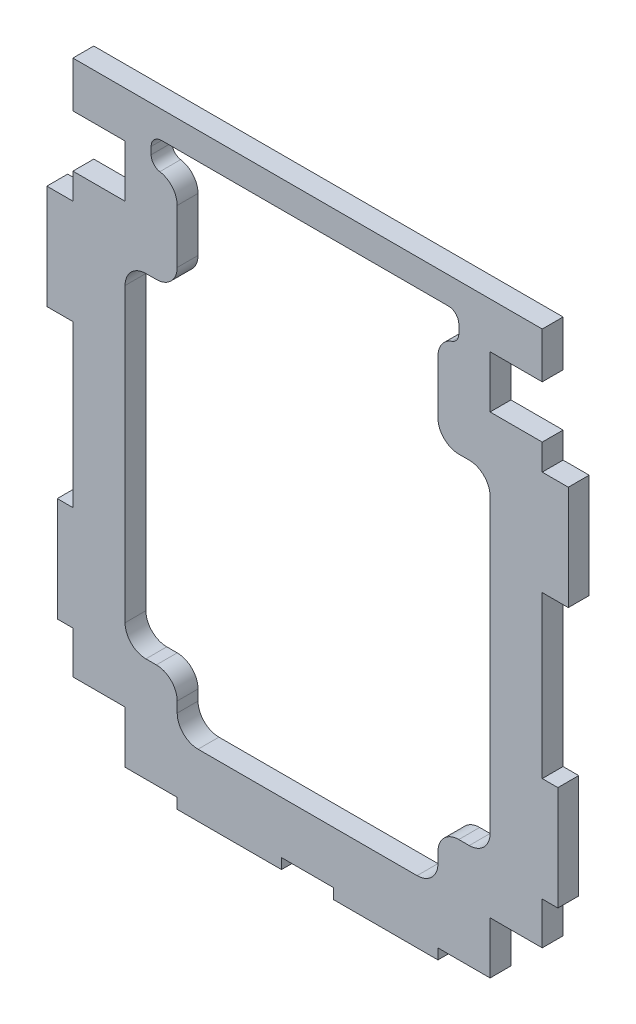
from build123d import *

# Parameters (mm, degrees)
EXTRUDE_1_DEPTH = 2


with BuildPart() as part:
    # Model → 凸台-拉伸1 (new body)
    with BuildSketch(Plane.XY):
        Polygon((1047.912570376, 680.457705055), (1047.912570376, 676.068532902), (1052.912570376, 676.068532902), (1052.912570376, 671.068532902), (1047.912570376, 671.068532902), (1047.912570376, 668.573157352), (1045.412570376, 668.573157352), (1045.412570376, 658.573157352), (1047.912570376, 658.573157352), (1047.912570376, 643.128332902), (1046.412570376, 643.128332902), (1046.412570376, 633.128332902), (1047.912570376, 633.128332902), (1047.912570376, 629.068532902), (1052.912570376, 629.068532902), (1052.912570376, 624.068532902), (1057.912570376, 624.068532902), (1057.912570376, 623.068532902), (1067.912570376, 623.068532902), (1067.912570376, 624.068532902), (1072.912570376, 624.068532902), (1072.912570376, 623.068532902), (1082.912570376, 623.068532902), (1082.912570376, 624.068532902), (1087.912570376, 624.068532902), (1087.912570376, 629.068532902), (1092.912570376, 629.068532902), (1092.912570376, 633.128332902), (1094.412570376, 633.128332902), (1094.412570376, 643.128332902), (1092.912570376, 643.128332902), (1092.912570376, 658.573157352), (1095.412570376, 658.573157352), (1095.412570376, 668.573157352), (1092.912570376, 668.573157352), (1092.912570376, 671.068532902), (1087.912570376, 671.068532902), (1087.912570376, 676.068532902), (1092.912570376, 676.068532902), (1092.912570376, 680.457705055), align=None)
        with BuildLine():
            Line((1057.912570376, 668.068532902), (1057.912570376, 673.218532902))
            ThreePointArc((1057.912570376, 673.218532902), (1057.440095607, 674.509527351), (1056.245903709, 675.190559496))
            ThreePointArc((1056.245903709, 675.190559496), (1055.64880776, 675.531075569), (1055.412570376, 676.176572793))
            Line((1055.412570376, 676.176572793), (1055.412570376, 676.867577668))
            ThreePointArc((1055.412570376, 676.867577668), (1055.705463595, 677.57468445), (1056.412570376, 677.867577668))
            Line((1056.412570376, 677.867577668), (1083.912570376, 677.867577668))
            ThreePointArc((1083.912570376, 677.867577668), (1084.619677157, 677.57468445), (1084.912570376, 676.867577668))
            Line((1084.912570376, 676.867577668), (1084.912570376, 676.046960027))
            ThreePointArc((1084.912570376, 676.046960027), (1084.729066957, 675.469609757), (1084.245903709, 675.104150985))
            ThreePointArc((1084.245903709, 675.104150985), (1083.279577214, 674.37323344), (1082.912570376, 673.218532902))
            Line((1082.912570376, 673.218532902), (1082.912570376, 668.068532902))
            ThreePointArc((1082.912570376, 668.068532902), (1083.498356813, 666.65431934), (1084.912570376, 666.068532902))
            Line((1084.912570376, 666.068532902), (1085.912570376, 666.068532902))
            ThreePointArc((1085.912570376, 666.068532902), (1087.326783938, 665.482746464), (1087.912570376, 664.068532902))
            Line((1087.912570376, 664.068532902), (1087.912570376, 636.068532902))
            ThreePointArc((1087.912570376, 636.068532902), (1087.326783938, 634.65431934), (1085.912570376, 634.068532902))
            Line((1085.912570376, 634.068532902), (1084.912570376, 634.068532902))
            ThreePointArc((1084.912570376, 634.068532902), (1083.498356813, 633.482746464), (1082.912570376, 632.068532902))
            Line((1082.912570376, 632.068532902), (1082.912570376, 631.068532902))
            ThreePointArc((1082.912570376, 631.068532902), (1082.326783938, 629.65431934), (1080.912570376, 629.068532902))
            Line((1080.912570376, 629.068532902), (1059.912570376, 629.068532902))
            ThreePointArc((1059.912570376, 629.068532902), (1058.498356813, 629.65431934), (1057.912570376, 631.068532902))
            Line((1057.912570376, 631.068532902), (1057.912570376, 632.068532902))
            ThreePointArc((1057.912570376, 632.068532902), (1057.326783938, 633.482746464), (1055.912570376, 634.068532902))
            Line((1055.912570376, 634.068532902), (1054.912570376, 634.068532902))
            ThreePointArc((1054.912570376, 634.068532902), (1053.498356813, 634.65431934), (1052.912570376, 636.068532902))
            Line((1052.912570376, 636.068532902), (1052.912570376, 664.068532902))
            ThreePointArc((1052.912570376, 664.068532902), (1053.498356813, 665.482746464), (1054.912570376, 666.068532902))
            Line((1054.912570376, 666.068532902), (1055.912570376, 666.068532902))
            ThreePointArc((1055.912570376, 666.068532902), (1057.326783938, 666.65431934), (1057.912570376, 668.068532902))
        make_face(mode=Mode.SUBTRACT)
    extrude(amount=EXTRUDE_1_DEPTH)


solid = part.part
